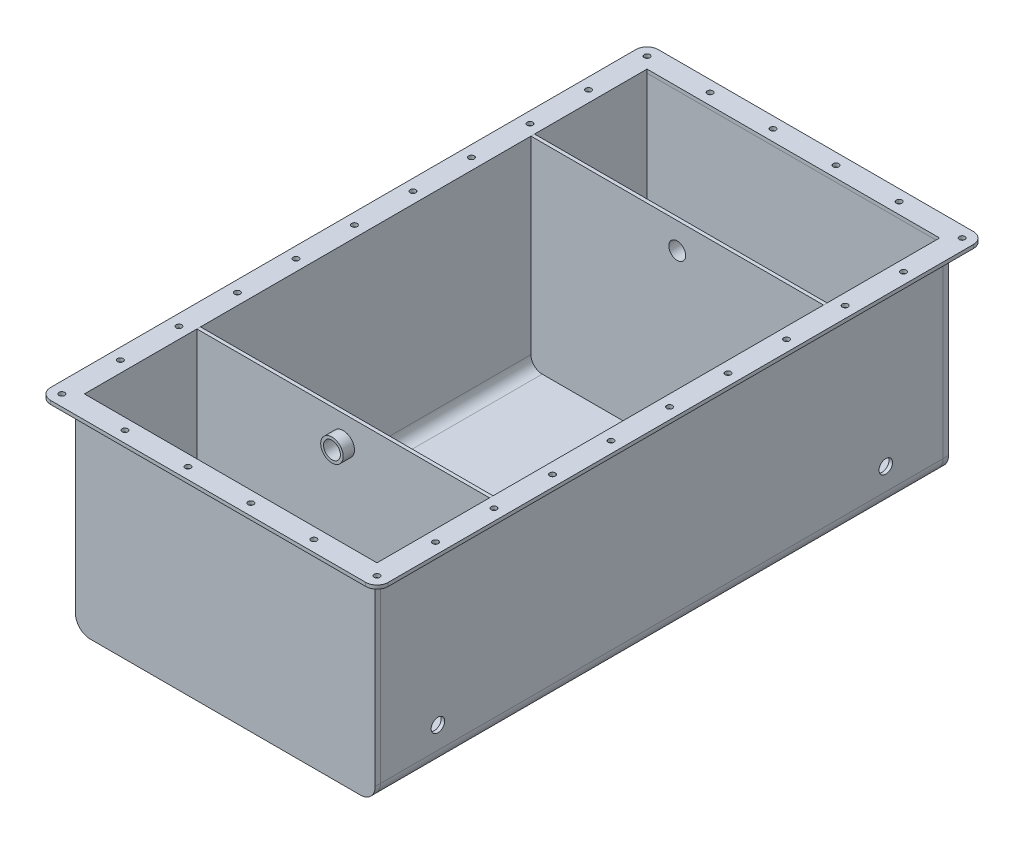
from build123d import *

# Parameters (mm, degrees)
INTERIOR_DIM_DEPTH      = 500
FILLET2_R               = 10
FILLET3_R               = 13.175
ENDCAP1_DEPTH           = 4.7625
COMPARTMENT1_BOSS_DEPTH = 3.175
SKETCH9_W               = 300
SKETCH9_H               = 540
SKETCH9_R               = 2.5
SKETCH9_W_2             = 260
SKETCH9_H_2             = 500
LID_FLANGE_DEPTH        = 3.175
FILLET4_R               = 10
ENDCAP2_DEPTH           = 4.7625
COMPARTMENT2_BOSS_DEPTH = 3.175
SKETCH16_R              = 6
BEARING_HOLES_DEPTH     = 619.331958781
WIRE_PASSTHROUGH_START  = -300
SKETCH17_R              = 7.5
WIRE_PASSTHROUGH_DEPTH  = 300
SKETCH18_W              = 260
SKETCH18_H              = 3.175
BOSS_EXTRUDE1_DEPTH     = 3.18
SKETCH17_3_R            = 10
SKETCH17_3_R_2          = 7.5
WIRE_TUBE_2_DEPTH       = 10
WIRE_TUBE_1_START       = 10
SKETCH19_R              = 10
SKETCH19_R_2            = 7.5
WIRE_TUBE_1_DEPTH       = 10


with BuildPart() as part:
    # Sketch2 → Interior Dim (new body)
    with BuildSketch(Plane.XY):
        Polygon((-130, 0), (130, 0), (130, 175), (133.175, 175), (133.175, -3.175), (-133.175, -3.175), (-133.175, 175), (-130, 175), align=None)
    extrude(amount=-INTERIOR_DIM_DEPTH)

    # Fillet2
    fillet2_edges = [part.edges().sort_by_distance(p)[0] for p in [
        (-130, 0, -250),
        (130, 0, -250),
    ]]
    fillet(fillet2_edges, radius=FILLET2_R)

    # Fillet3
    fillet3_edges = [part.edges().sort_by_distance(p)[0] for p in [
        (-133.175, -3.175, -250),
        (133.175, -3.175, -250),
    ]]
    fillet(fillet3_edges, radius=FILLET3_R)



with BuildPart() as body_2:
    # Sketch4 → Endcap1 (new body)
    with BuildSketch(Plane.XY):
        with BuildLine():
            Line((-130, 175), (130, 175))
            Line((130, 175), (133.175, 175))
            Line((133.175, 175), (133.175, 10))
            ThreePointArc((133.175, 10), (129.316131842, 0.683868158), (120, -3.175))
            Line((120, -3.175), (-120, -3.175))
            ThreePointArc((-120, -3.175), (-129.316131842, 0.683868158), (-133.175, 10))
            Line((-133.175, 10), (-133.175, 175))
            Line((-133.175, 175), (-130, 175))
        make_face()
    extrude(amount=ENDCAP1_DEPTH)


with BuildPart() as body_3:
    # Sketch7 → Compartment1_Boss (new body)
    with BuildSketch(Plane(origin=(0, 0, -100), x_dir=(-1, 0, 0), z_dir=(0, 0, -1))):
        with BuildLine():
            Line((120, 0), (-120, 0))
            ThreePointArc((-120, 0), (-127.071067812, 2.928932188), (-130, 10))
            Line((-130, 10), (-130, 175))
            Line((-130, 175), (130, 175))
            Line((130, 175), (130, 10))
            ThreePointArc((130, 10), (127.071067812, 2.928932188), (120, 0))
        make_face()
    extrude(amount=COMPARTMENT1_BOSS_DEPTH)


with BuildPart() as body_4:
    # Sketch9 → Lid_Flange (new body)
    with BuildSketch(Plane(origin=(0, 175, 0), x_dir=(1, 0, 0), z_dir=(0, 1, 0))):
        with Locations((0, 250)):
            Rectangle(SKETCH9_W, SKETCH9_H)
        with Locations(Location((-140, -10, 0), (0, 0, 270))):
            Circle(SKETCH9_R, mode=Mode.SUBTRACT)
        with Locations(Location((-140, 42, 0), (0, 0, 270))):
            Circle(SKETCH9_R, mode=Mode.SUBTRACT)
        with Locations(Location((-140, 94, 0), (0, 0, 270))):
            Circle(SKETCH9_R, mode=Mode.SUBTRACT)
        with Locations(Location((-140, 146, 0), (0, 0, 270))):
            Circle(SKETCH9_R, mode=Mode.SUBTRACT)
        with Locations(Location((-140, 198, 0), (0, 0, 270))):
            Circle(SKETCH9_R, mode=Mode.SUBTRACT)
        with Locations(Location((-140, 250, 0), (0, 0, 270))):
            Circle(SKETCH9_R, mode=Mode.SUBTRACT)
        with Locations(Location((-140, 302, 0), (0, 0, 270))):
            Circle(SKETCH9_R, mode=Mode.SUBTRACT)
        with Locations(Location((-140, 354, 0), (0, 0, 270))):
            Circle(SKETCH9_R, mode=Mode.SUBTRACT)
        with Locations(Location((-140, 406, 0), (0, 0, 270))):
            Circle(SKETCH9_R, mode=Mode.SUBTRACT)
        with Locations(Location((-140, 458, 0), (0, 0, 270))):
            Circle(SKETCH9_R, mode=Mode.SUBTRACT)
        with Locations(Location((-140, 510, 0), (0, 0, 270))):
            Circle(SKETCH9_R, mode=Mode.SUBTRACT)
        with Locations(Location((-84, 510, 0), (0, 0, 270))):
            Circle(SKETCH9_R, mode=Mode.SUBTRACT)
        with Locations(Location((-28, 510, 0), (0, 0, 270))):
            Circle(SKETCH9_R, mode=Mode.SUBTRACT)
        with Locations(Location((28, 510, 0), (0, 0, 270))):
            Circle(SKETCH9_R, mode=Mode.SUBTRACT)
        with Locations(Location((84, 510, 0), (0, 0, 270))):
            Circle(SKETCH9_R, mode=Mode.SUBTRACT)
        with Locations(Location((140, 510, 0), (0, 0, 270))):
            Circle(SKETCH9_R, mode=Mode.SUBTRACT)
        with Locations(Location((140, 458, 0), (0, 0, 270))):
            Circle(SKETCH9_R, mode=Mode.SUBTRACT)
        with Locations(Location((140, 406, 0), (0, 0, 270))):
            Circle(SKETCH9_R, mode=Mode.SUBTRACT)
        with Locations(Location((140, 354, 0), (0, 0, 270))):
            Circle(SKETCH9_R, mode=Mode.SUBTRACT)
        with Locations(Location((140, 302, 0), (0, 0, 270))):
            Circle(SKETCH9_R, mode=Mode.SUBTRACT)
        with Locations(Location((140, 250, 0), (0, 0, 270))):
            Circle(SKETCH9_R, mode=Mode.SUBTRACT)
        with Locations(Location((140, 198, 0), (0, 0, 270))):
            Circle(SKETCH9_R, mode=Mode.SUBTRACT)
        with Locations(Location((140, 146, 0), (0, 0, 270))):
            Circle(SKETCH9_R, mode=Mode.SUBTRACT)
        with Locations(Location((140, 94, 0), (0, 0, 270))):
            Circle(SKETCH9_R, mode=Mode.SUBTRACT)
        with Locations(Location((140, 42, 0), (0, 0, 270))):
            Circle(SKETCH9_R, mode=Mode.SUBTRACT)
        with Locations(Location((140, -10, 0), (0, 0, 270))):
            Circle(SKETCH9_R, mode=Mode.SUBTRACT)
        with Locations(Location((84, -10, 0), (0, 0, 270))):
            Circle(SKETCH9_R, mode=Mode.SUBTRACT)
        with Locations(Location((28, -10, 0), (0, 0, 270))):
            Circle(SKETCH9_R, mode=Mode.SUBTRACT)
        with Locations(Location((-28, -10, 0), (0, 0, 270))):
            Circle(SKETCH9_R, mode=Mode.SUBTRACT)
        with Locations(Location((-84, -10, 0), (0, 0, 270))):
            Circle(SKETCH9_R, mode=Mode.SUBTRACT)
        with Locations((0, 250)):
            Rectangle(SKETCH9_W_2, SKETCH9_H_2, mode=Mode.SUBTRACT)
    extrude(amount=LID_FLANGE_DEPTH)

    # Fillet4
    fillet4_edges = [body_4.edges().sort_by_distance(p)[0] for p in [
        (150, 176.5875, -520),
        (150, 176.5875, 20),
        (-150, 176.5875, 20),
        (-150, 176.5875, -520),
    ]]
    fillet(fillet4_edges, radius=FILLET4_R)


with BuildPart() as body_5:
    # Sketch5 → Endcap2 (new body)
    with BuildSketch(Plane(origin=(0, 0, -500), x_dir=(-1, 0, 0), z_dir=(0, 0, -1))):
        with BuildLine():
            Line((133.175, 175), (-133.175, 175))
            Line((-133.175, 175), (-133.175, 10))
            ThreePointArc((-133.175, 10), (-129.316131842, 0.683868158), (-120, -3.175))
            Line((-120, -3.175), (120, -3.175))
            ThreePointArc((120, -3.175), (129.316131842, 0.683868158), (133.175, 10))
            Line((133.175, 10), (133.175, 175))
        make_face()
    extrude(amount=ENDCAP2_DEPTH)


with BuildPart() as part_1:
    add(part.part)

    add(body_4.part)  # Compartment2_Boss merges body 4
    # Sketch13 → Compartment2_Boss (add)
    with BuildSketch(Plane.XY.offset(-400)):
        with BuildLine():
            Line((130, 175), (-130, 175))
            Line((-130, 175), (-130, 10))
            ThreePointArc((-130, 10), (-127.071067812, 2.928932188), (-120, 0))
            Line((-120, 0), (120, 0))
            ThreePointArc((120, 0), (127.071067812, 2.928932188), (130, 10))
            Line((130, 10), (130, 175))
        make_face()
    extrude(amount=COMPARTMENT2_BOSS_DEPTH)

    # Sketch16 → Bearing_holes (cut, through all)
    with BuildSketch(Plane.ZY.offset(133.175)):
        with Locations((-449, 29.5)):
            Circle(SKETCH16_R)
        with Locations((-51, 29.5)):
            Circle(SKETCH16_R)
    extrude(amount=-BEARING_HOLES_DEPTH, mode=Mode.SUBTRACT)


with BuildPart() as wire_passthrough_tool:
    # Sketch17 → Wire_Passthrough (new body)
    with BuildSketch(Plane(origin=(0, 0, -400), x_dir=(-1, 0, 0), z_dir=(0, 0, -1)).offset(WIRE_PASSTHROUGH_START)):
        with Locations((0, 155)):
            Circle(SKETCH17_R)
    extrude(amount=WIRE_PASSTHROUGH_DEPTH)


with BuildPart() as part_2:
    add(part_1.part)

    # Wire_Passthrough: cut by wire_passthrough_tool
    add(wire_passthrough_tool.part, mode=Mode.SUBTRACT)



with BuildPart() as body_3_1:
    add(body_3.part)

    # Wire_Passthrough: cut by wire_passthrough_tool
    add(wire_passthrough_tool.part, mode=Mode.SUBTRACT)


with BuildPart() as part_3:
    add(part_2.part)

    add(body_3_1.part)  # Boss-Extrude1 merges body 3
    # Sketch18 → Boss-Extrude1 (add)
    with BuildSketch(Plane(origin=(0, 175, 0), x_dir=(1, 0, 0), z_dir=(0, 1, 0))):
        with Locations((0, 398.4125)):
            Rectangle(SKETCH18_W, SKETCH18_H)
        with Locations((0, 101.5875)):
            Rectangle(SKETCH18_W, SKETCH18_H)
    extrude(amount=BOSS_EXTRUDE1_DEPTH)

    # Sketch17<3> → Wire_Tube_2 (add)
    with BuildSketch(Plane(origin=(0, 0, -400), x_dir=(-1, 0, 0), z_dir=(0, 0, -1))):
        with Locations((0, 155)):
            Circle(SKETCH17_3_R)
        with Locations((0, 155)):
            Circle(SKETCH17_3_R_2, mode=Mode.SUBTRACT)
    extrude(amount=WIRE_TUBE_2_DEPTH)

    # Sketch19 → Wire_Tube_1 (add)
    with BuildSketch(Plane.XY.offset(-100).offset(WIRE_TUBE_1_START)):
        with Locations(Location((0, 155, 0), (0, 0, 180))):
            Circle(SKETCH19_R)
        with Locations(Location((0, 155, 0), (0, 0, 180))):
            Circle(SKETCH19_R_2, mode=Mode.SUBTRACT)
    extrude(amount=-WIRE_TUBE_1_DEPTH)


solid = Compound([body_2.part, body_5.part, part_3.part])
